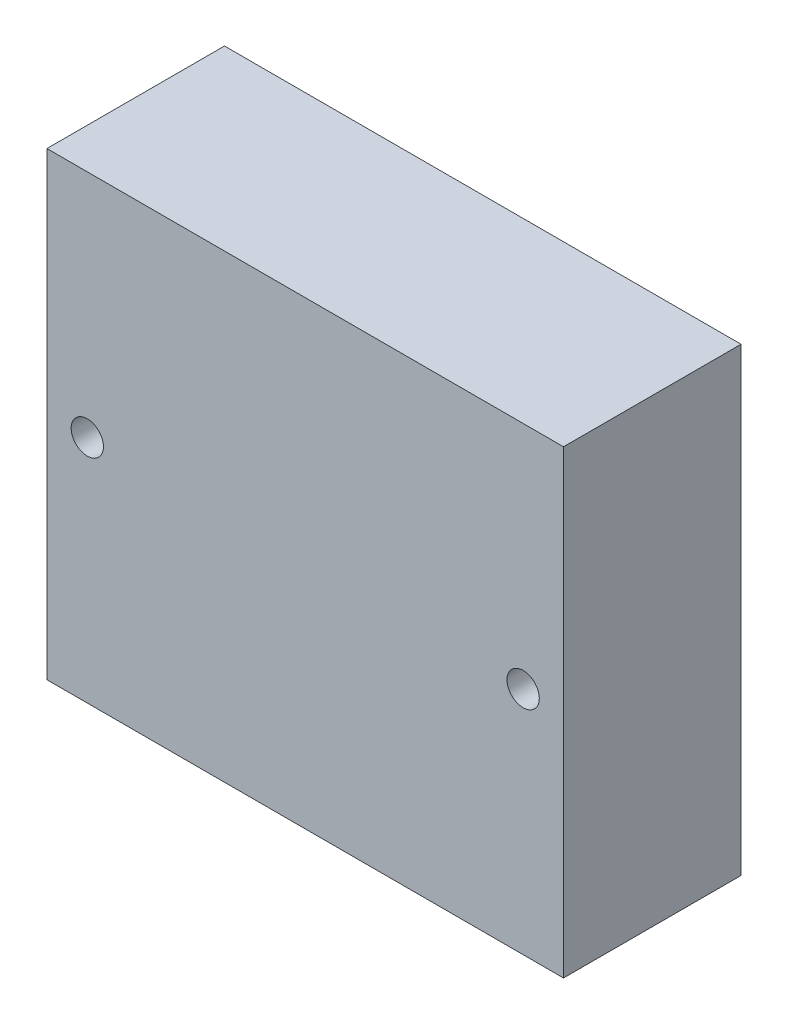
from build123d import *

# Parameters (mm, degrees)
ESQUISSE1_W        = 64
ESQUISSE1_H        = 57
ESQUISSE1_R        = 2
BOSS_EXTRU_1_DEPTH = 22


with BuildPart() as part:
    # Esquisse1 → Boss.-Extru.1 (new body)
    with BuildSketch(Plane.XY):
        Rectangle(ESQUISSE1_W, ESQUISSE1_H)
        with Locations((-27, 0)):
            Circle(ESQUISSE1_R, mode=Mode.SUBTRACT)
        with Locations((27, 0)):
            Circle(ESQUISSE1_R, mode=Mode.SUBTRACT)
    extrude(amount=BOSS_EXTRU_1_DEPTH)


solid = part.part
